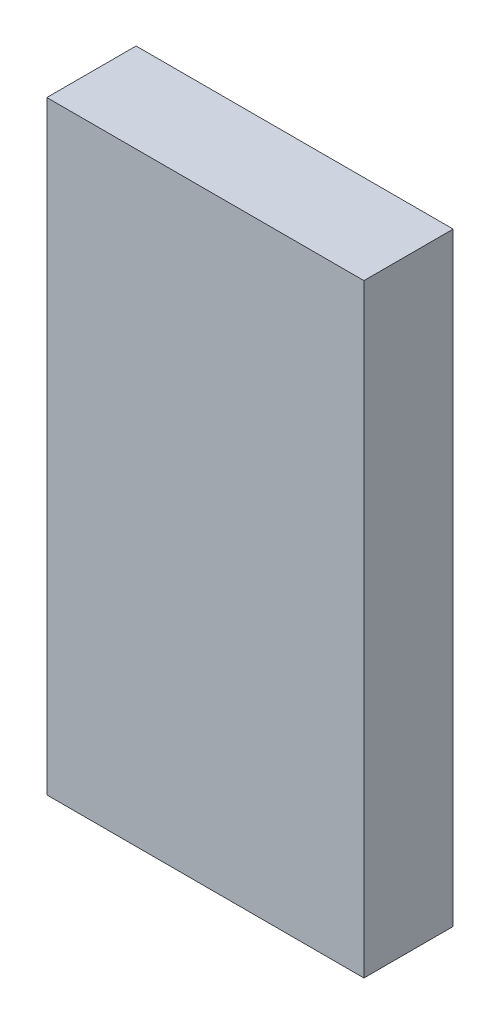
from build123d import *

# Parameters (mm, degrees)
SZKIC1_W                    = 53.3
SZKIC1_H                    = 101.52
DODANIE_WYCI_GNI_CIE1_DEPTH = 15


with BuildPart() as part:
    # Szkic1 → Dodanie-wyciągnięcie1 (new body)
    with BuildSketch(Plane.XY):
        with Locations((26.65, 50.76)):
            Rectangle(SZKIC1_W, SZKIC1_H)
    extrude(amount=DODANIE_WYCI_GNI_CIE1_DEPTH)


solid = part.part
